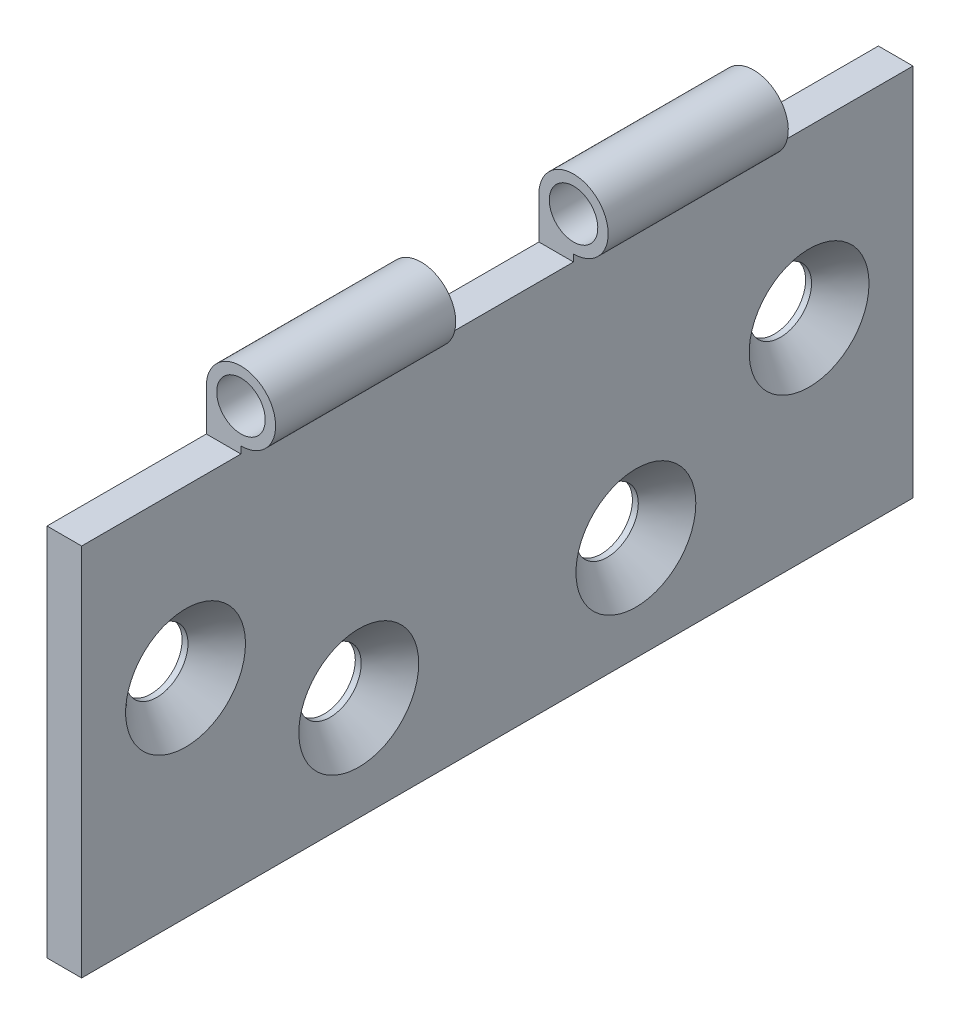
from build123d import *

# Parameters (mm, degrees)
SKETCH_1_W                 = 5
SKETCH_1_H                 = 60
EXTRUDE_1_DEPTH            = 60
SKETCH_2_R                 = 5
SKETCH_4_R                 = 3.5
CUT_EXTRUDE_1_DEPTH        = 137.839321834
HOLE_WIZARD_M81_AT_2_COUNT = 2
HOLE_WIZARD_M81_AT_2_PITCH = 29.154759474
CUT_EXTRUDE_2_DEPTH        = 89.600225733
CUT_EXTRUDE_2_DEPTH_BACK   = 89.600225733
SKETCH_7_W                 = 23
SKETCH_7_H                 = 11
SKETCH_7_W_2               = 22


with BuildPart() as part:
    # Эскиз1 → Вытянуть-Тонкостенный1 (new, symmetric)
    with BuildSketch(Plane.XY):
        with Locations((2.5, 30)):
            Rectangle(SKETCH_1_W, SKETCH_1_H)
    extrude(amount=EXTRUDE_1_DEPTH, both=True)

    # По траектории1: sweep along a curve in space
    with BuildLine() as sweep_1_path:
        Line((5, 60, 60), (5, 60, -60))
    # Эскиз2 → По траектории1 (sweep)
    with BuildSketch(Plane.XY.offset(60)):
        with Locations((5, 60)):
            Circle(SKETCH_2_R)
    sweep(path=sweep_1_path.line)

    # Эскиз4 → Вырез-Вытянуть1 (cut, through all)
    with BuildSketch(Plane.XY.offset(60)):
        with Locations((5, 60)):
            Circle(SKETCH_4_R)
    extrude(amount=-CUT_EXTRUDE_1_DEPTH, mode=Mode.SUBTRACT)

    # Эскиз5 → Зенковка для  винта с плоской головкой M81 (revolve, cut)
    with BuildSketch(Plane(origin=(5, 30, 45), x_dir=(0, 0, -1), z_dir=(0, 1, 0))):
        Polygon((0, 0), (0, 5), (4.5, 5), (4.5, 4.15), (8.65, 0), align=None)
    hole_wizard_m81 = revolve(axis=Axis((11.35, 30, 45), (-1, 0, 0)), mode=Mode.SUBTRACT)

    # Зенковка для  винта с плоской головкой M81 at 2: Зенковка для  винта с плоской головкой M81 ×2
    with Locations(*[Vector(0, -0.5144957554275265, -0.8574929257125442) * (i * HOLE_WIZARD_M81_AT_2_PITCH) for i in range(1, HOLE_WIZARD_M81_AT_2_COUNT)]):
        add(hole_wizard_m81, mode=Mode.SUBTRACT)

    # Зеркальное отражение1: Зенковка для  винта с плоской головкой M81 across plane
    add(hole_wizard_m81.mirror(Plane.XY), mode=Mode.SUBTRACT)

    # Зеркальное отражение1 copy 1 sketch → Зеркальное отражение1 copy 1 (revolve, cut)
    with BuildSketch(Plane(origin=(5, 15, -20), x_dir=(0, 0, 1), z_dir=(0, 1, 0))):
        Polygon((0, 0), (0, -5), (4.5, -5), (4.5, -4.15), (8.65, 0), align=None)
    revolve(axis=Axis((11.35, 15, -20), (1, 0, 0)), mode=Mode.SUBTRACT)

    # Эскиз7 → Вырез-Вытянуть2 (cut, two sides: drawn at the far end of the back side and taken through both)
    with BuildSketch(Plane(origin=(5, 0, 0), x_dir=(0, 0, -1), z_dir=(1, 0, 0)).offset(-CUT_EXTRUDE_2_DEPTH_BACK)):
        with Locations((48.5, 59.5)):
            Rectangle(SKETCH_7_W, SKETCH_7_H)
        with Locations((-48.5, 59.5)):
            Rectangle(SKETCH_7_W, SKETCH_7_H)
        with Locations((0, 59.5)):
            Rectangle(SKETCH_7_W_2, SKETCH_7_H)
    extrude(amount=CUT_EXTRUDE_2_DEPTH + CUT_EXTRUDE_2_DEPTH_BACK, mode=Mode.SUBTRACT)


solid = part.part
